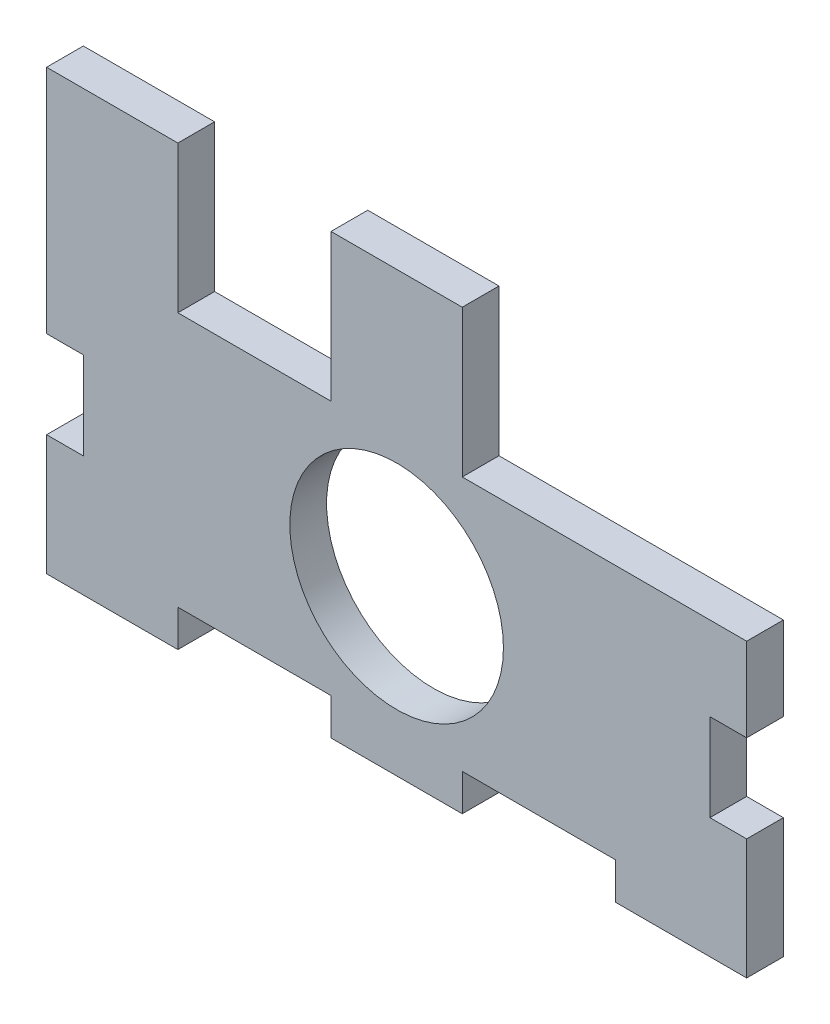
from build123d import *

# Parameters (mm, degrees)
SKETCH1_W           = 101.6
SKETCH1_H           = 36.999999914
BOSS_EXTRUDE1_DEPTH = 5.334
SKETCH2_R           = 15.499999988
MOTORHOLES_DEPTH    = 55.326251062
SKETCH3_W           = 19.05
SKETCH3_H           = 5.334
SKETCH3_H_2         = 5.334001831
BOTTOMTEETH_DEPTH   = 5.334
SKETCH4_W           = 10.668
SKETCH4_H           = 12.7
SIDECUT_DEPTH       = 57.36622313
SKETCH5_W           = 19.05
SKETCH5_H           = 5.334
TOPTEETH_DEPTH      = 21.336


with BuildPart() as part:
    # Sketch1 → Boss-Extrude1 (new body)
    with BuildSketch(Plane.XY):
        Rectangle(SKETCH1_W, SKETCH1_H)
    extrude(amount=BOSS_EXTRUDE1_DEPTH)

    # Sketch2 → MotorHoles (cut, through all)
    with BuildSketch(Plane.XY.offset(5.334)):
        Circle(SKETCH2_R)
    extrude(amount=-MOTORHOLES_DEPTH, mode=Mode.SUBTRACT)

    # Sketch3 → BottomTeeth (add)
    with BuildSketch(Plane.XZ.offset(18.499999957)):
        with Locations((-41.275, 2.667)):
            Rectangle(SKETCH3_W, SKETCH3_H)
        with Locations((41.275, 2.667)):
            Rectangle(SKETCH3_W, SKETCH3_H)
        with Locations((0, 2.667000916)):
            Rectangle(SKETCH3_W, SKETCH3_H_2)
    extrude(amount=BOTTOMTEETH_DEPTH)

    # Sketch4 → SideCut (cut, through all)
    with BuildSketch(Plane.XY.offset(5.334)):
        with Locations((-50.8, 0)):
            Rectangle(SKETCH4_W, SKETCH4_H)
        with Locations((50.8, 0)):
            Rectangle(SKETCH4_W, SKETCH4_H)
    extrude(amount=-SIDECUT_DEPTH, mode=Mode.SUBTRACT)

    # Sketch5 → TopTeeth (add)
    with BuildSketch(Plane(origin=(0, 18.499999957, 0), x_dir=(1, 0, 0), z_dir=(0, 1, 0))):
        with Locations((-41.275, -2.667)):
            Rectangle(SKETCH5_W, SKETCH5_H)
        with Locations((0, -2.667)):
            Rectangle(SKETCH5_W, SKETCH5_H)
    extrude(amount=TOPTEETH_DEPTH)


solid = part.part
